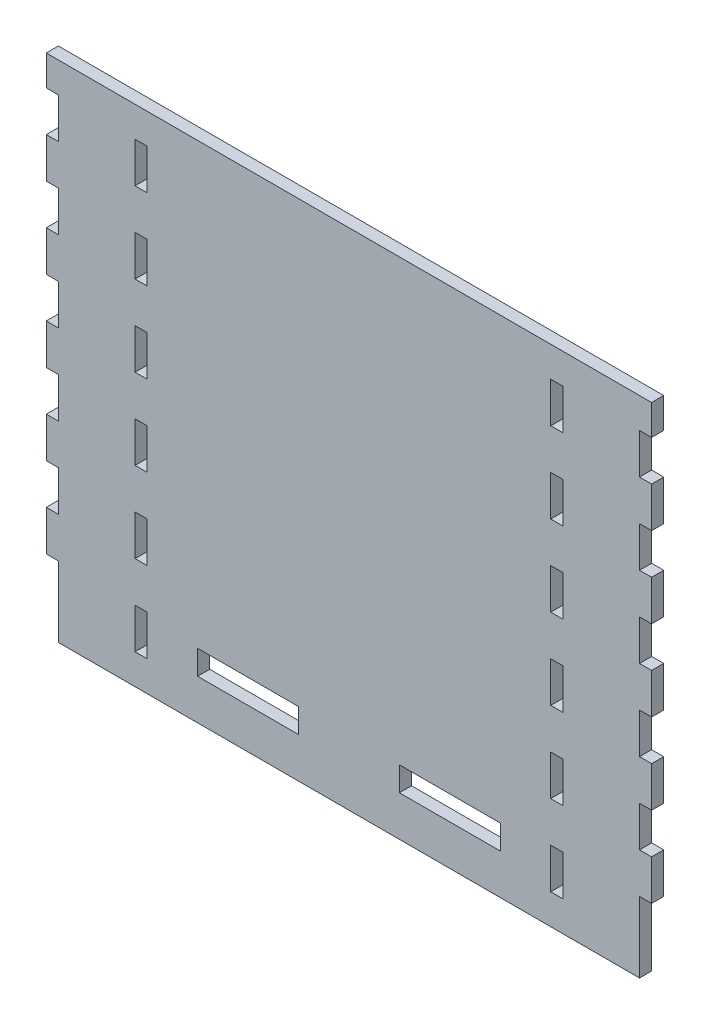
from build123d import *

# Parameters (mm, degrees)
SKETCH_1_W      = 50
SKETCH_1_H      = 12
SKETCH_1_W_2    = 6
SKETCH_1_H_2    = 20
EXTRUDE_1_DEPTH = 6


with BuildPart() as part:
    # 草图1 → 凸台-拉伸1 (new body)
    with BuildSketch(Plane.XY):
        Polygon((-99.950071484, 5.412625096), (-99.950071484, -14.587374904), (-93.950071484, -14.587374904), (-93.950071484, -34.587374904), (-99.950071484, -34.587374904), (-99.950071484, -54.587374904), (-93.950071484, -54.587374904), (-93.950071484, -74.587374904), (-99.950071484, -74.587374904), (-99.950071484, -94.587374904), (-93.950071484, -94.587374904), (-93.950071484, -129.587374904), (194.049928516, -129.587374904), (194.049928516, -94.587374904), (200.049928516, -94.587374904), (200.049928516, -74.587374904), (194.049928516, -74.587374904), (194.049928516, -54.587374904), (200.049928516, -54.587374904), (200.049928516, -34.587374904), (194.049928516, -34.587374904), (194.049928516, -14.587374904), (200.049928516, -14.587374904), (200.049928516, 5.412625096), (194.049928516, 5.412625096), (194.049928516, 25.412625096), (200.049928516, 25.412625096), (200.049928516, 45.412625096), (194.049928516, 45.412625096), (194.049928516, 65.412625096), (200.049928516, 65.412625096), (200.049928516, 85.412625096), (194.049928516, 85.412625096), (194.049928516, 105.412625096), (200.049928516, 105.412625096), (200.049928516, 120.412625096), (194.049928516, 120.412625096), (-93.950071484, 120.412625096), (-99.950071484, 120.412625096), (-99.950071484, 105.412625096), (-93.950071484, 105.412625096), (-93.950071484, 85.412625096), (-99.950071484, 85.412625096), (-99.950071484, 65.412625096), (-93.950071484, 65.412625096), (-93.950071484, 45.412625096), (-99.950071484, 45.412625096), (-99.950071484, 25.412625096), (-93.950071484, 25.412625096), (-93.950071484, 5.412625096), align=None)
        with Locations((100.049928516, -103.587374904)):
            Rectangle(SKETCH_1_W, SKETCH_1_H, mode=Mode.SUBTRACT)
        with Locations((153.049928516, 15.412625096)):
            Rectangle(SKETCH_1_W_2, SKETCH_1_H_2, mode=Mode.SUBTRACT)
        with Locations((153.049928516, -64.587374904)):
            Rectangle(SKETCH_1_W_2, SKETCH_1_H_2, mode=Mode.SUBTRACT)
        with Locations((153.049928516, 55.412625096)):
            Rectangle(SKETCH_1_W_2, SKETCH_1_H_2, mode=Mode.SUBTRACT)
        with Locations((153.049928516, -104.587374904)):
            Rectangle(SKETCH_1_W_2, SKETCH_1_H_2, mode=Mode.SUBTRACT)
        with Locations((153.049928516, 95.412625096)):
            Rectangle(SKETCH_1_W_2, SKETCH_1_H_2, mode=Mode.SUBTRACT)
        with Locations((153.049928516, -24.587374904)):
            Rectangle(SKETCH_1_W_2, SKETCH_1_H_2, mode=Mode.SUBTRACT)
        with Locations((-52.950071484, -24.587374904)):
            Rectangle(SKETCH_1_W_2, SKETCH_1_H_2, mode=Mode.SUBTRACT)
        with Locations((-52.950071484, -64.587374904)):
            Rectangle(SKETCH_1_W_2, SKETCH_1_H_2, mode=Mode.SUBTRACT)
        with Locations((-52.950071484, -104.587374904)):
            Rectangle(SKETCH_1_W_2, SKETCH_1_H_2, mode=Mode.SUBTRACT)
        with Locations((-52.950071484, 55.412625096)):
            Rectangle(SKETCH_1_W_2, SKETCH_1_H_2, mode=Mode.SUBTRACT)
        with Locations((-52.950071484, 95.412625096)):
            Rectangle(SKETCH_1_W_2, SKETCH_1_H_2, mode=Mode.SUBTRACT)
        with Locations((-52.950071484, 15.412625096)):
            Rectangle(SKETCH_1_W_2, SKETCH_1_H_2, mode=Mode.SUBTRACT)
        with Locations((0.049928516, -103.587374904)):
            Rectangle(SKETCH_1_W, SKETCH_1_H, mode=Mode.SUBTRACT)
    extrude(amount=EXTRUDE_1_DEPTH)


solid = part.part
